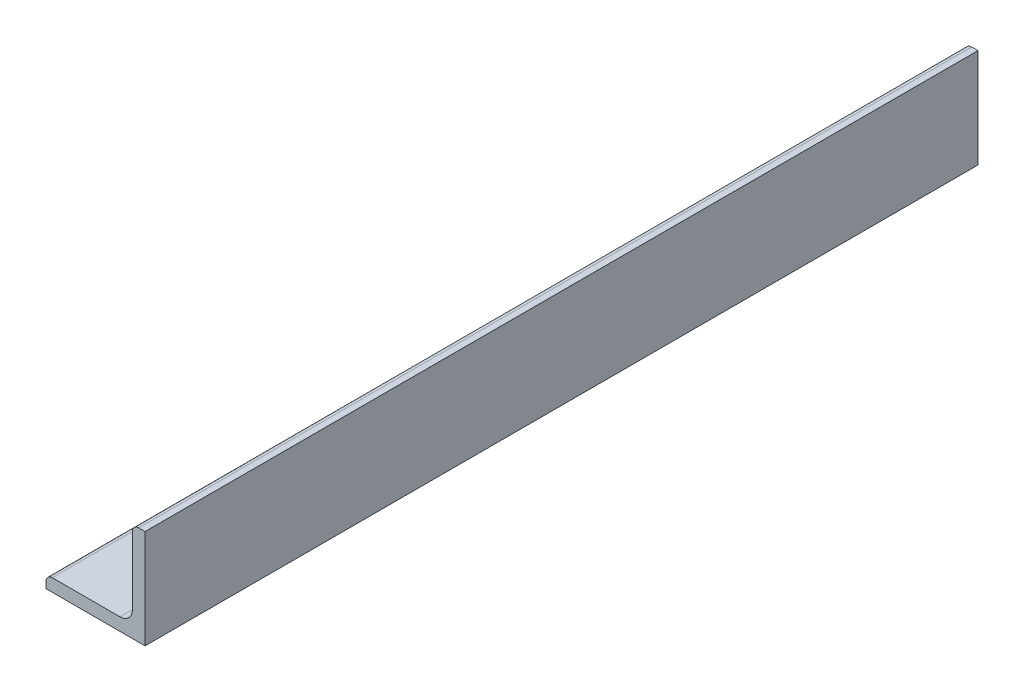
from build123d import *

# Parameters (mm, degrees)
BOSS_EXTRUDE1_DEPTH     = 152.4
CUT_EXTRUDE1_START      = -6.35
CUT_EXTRUDE1_DEPTH      = 6.35
CUT_EXTRUDE2_DEPTH      = 154.454683865
CUT_EXTRUDE2_DEPTH_BACK = 154.454683865
SKETCH4_W               = 35.4
SKETCH4_H               = 35.921024484
SKETCH5_W               = 49.45
SKETCH5_H               = 25.4
CUT_EXTRUDE3_DEPTH      = 156.02325632


with BuildPart() as part:
    # Sketch2 → Boss-Extrude1 (new, symmetric)
    with BuildSketch(Plane.XY):
        with BuildLine():
            Line((-12.7, -12.7), (12.7, -12.7))
            Line((12.7, -12.7), (12.7, 12.7))
            Line((12.7, 12.7), (11.0749969, 12.7))
            ThreePointArc((11.0749969, 12.7), (9.925946189, 12.224047611), (9.4499938, 11.0749969))
            Line((9.4499938, 11.0749969), (9.4499938, -6.2749938))
            ThreePointArc((9.4499938, -6.2749938), (8.52005783, -8.52005783), (6.2749938, -9.4499938))
            Line((6.2749938, -9.4499938), (-11.0749969, -9.4499938))
            ThreePointArc((-11.0749969, -9.4499938), (-12.224047611, -9.925946189), (-12.7, -11.0749969))
            Line((-12.7, -11.0749969), (-12.7, -12.7))
        make_face()
    extrude(amount=BOSS_EXTRUDE1_DEPTH, both=True)

    # Sketch3 → Cut-Extrude1 (cut)
    with BuildSketch(Plane(origin=(0, 0, -152.4), x_dir=(-1, 0, 0), z_dir=(0, 0, -1)).offset(CUT_EXTRUDE1_START)):
        with BuildLine():
            Line((12.7, -12.7), (12.7, -11.0749969))
            ThreePointArc((12.7, -11.0749969), (12.224047611, -9.925946189), (11.0749969, -9.4499938))
            Line((11.0749969, -9.4499938), (-6.2749938, -9.4499938))
            ThreePointArc((-6.2749938, -9.4499938), (-8.52005783, -8.52005783), (-9.4499938, -6.2749938))
            Line((-9.4499938, -6.2749938), (-9.4499938, 11.0749969))
            ThreePointArc((-9.4499938, 11.0749969), (-9.925946189, 12.224047611), (-11.0749969, 12.7))
            Line((-11.0749969, 12.7), (-12.7, 12.7))
            Line((-12.7, 12.7), (-12.7, -12.7))
            Line((-12.7, -12.7), (12.7, -12.7))
        make_face()
    extrude(amount=CUT_EXTRUDE1_DEPTH, mode=Mode.SUBTRACT)

    # Sketch4 → Cut-Extrude2 (cut, two sides: drawn at the far end of the back side and taken through both)
    with BuildSketch(Plane(origin=(0, 0, 0), x_dir=(0, 0, -1), z_dir=(0.7071067811865476, -0.7071067811865475, 0)).offset(-CUT_EXTRUDE2_DEPTH_BACK)):
        with Locations((128.35, 0)):
            Rectangle(SKETCH4_W, SKETCH4_H)
    extrude(amount=CUT_EXTRUDE2_DEPTH + CUT_EXTRUDE2_DEPTH_BACK, mode=Mode.SUBTRACT)

    # Sketch5 → Cut-Extrude3 (cut, through all)
    with BuildSketch(Plane(origin=(12.7, 0, 0), x_dir=(0, 0, -1), z_dir=(1, 0, 0))):
        with Locations((-127.675, 0)):
            Rectangle(SKETCH5_W, SKETCH5_H)
    extrude(amount=-CUT_EXTRUDE3_DEPTH, mode=Mode.SUBTRACT)


solid = part.part
